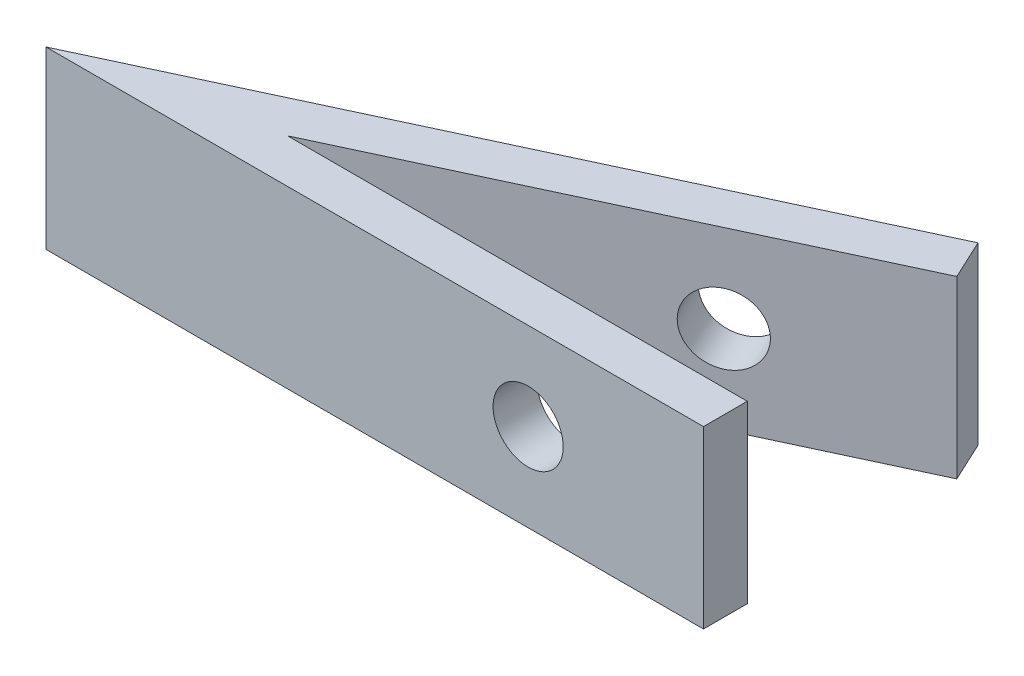
from build123d import *

# Parameters (mm, degrees)
BOSS_EXTRUDE1_DEPTH = 20
SKETCH2_R           = 4
CUT_EXTRUDE2_DEPTH  = 5
SKETCH3_R           = 4
CUT_EXTRUDE3_DEPTH  = 5


with BuildPart() as part:
    # Sketch1 → Boss-Extrude1 (new body)
    with BuildSketch(Plane(origin=(0, 0, 0), x_dir=(1, 0, 0), z_dir=(0, 1, 0))):
        Polygon((0, 0), (37.679677005, 0), (37.679677005, 5), (-14.766780477, 5), (37.297391276, 29.277922004), (35.184299968, 33.809460939), (-37.320322995, 0), align=None)
    extrude(amount=BOSS_EXTRUDE1_DEPTH)

    # Sketch2 → Cut-Extrude2 (cut)
    with BuildSketch(Plane(origin=(-6.665640892, 0, -14.294513023), x_dir=(-0.9063077870366526, 0, 0.42261826174069417), z_dir=(-0.42261826174069417, 0, -0.9063077870366526))):
        with Locations((-26.176300655, 10)):
            Circle(SKETCH2_R)
    extrude(amount=-CUT_EXTRUDE2_DEPTH, mode=Mode.SUBTRACT)

    # Sketch3 → Cut-Extrude3 (cut)
    with BuildSketch(Plane.XY):
        with Locations((17.679677005, 10)):
            Circle(SKETCH3_R)
    extrude(amount=-CUT_EXTRUDE3_DEPTH, mode=Mode.SUBTRACT)


solid = part.part
